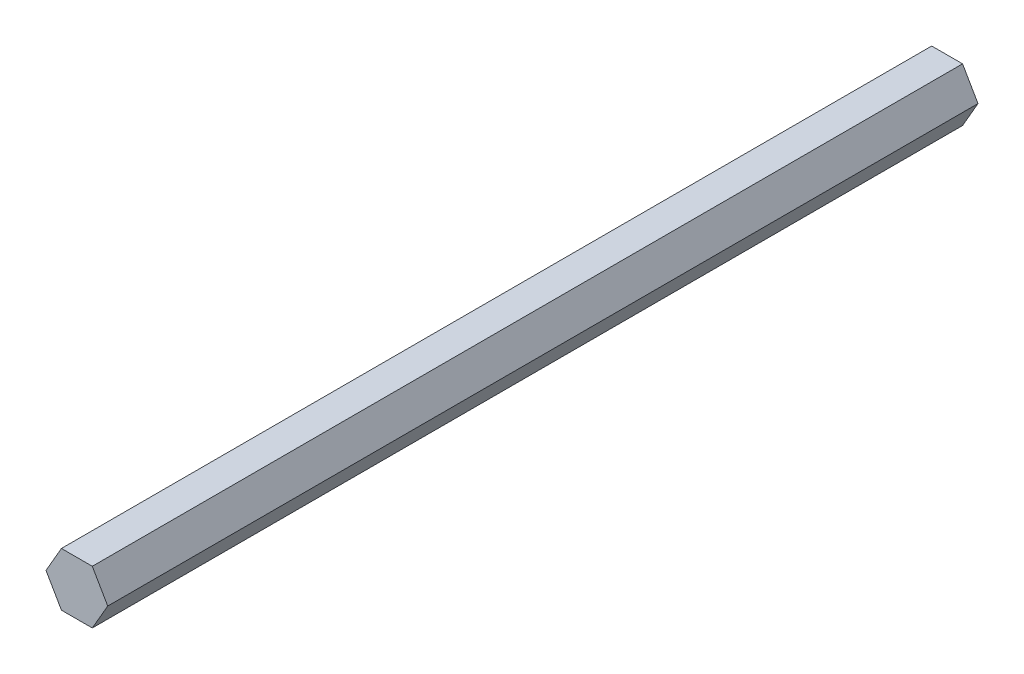
from build123d import *

# Parameters (mm, degrees)
BOSS_EXTRUDE1_DEPTH = 103.378


with BuildPart() as part:
    # Sketch1 → Boss-Extrude1 (new, symmetric)
    with BuildSketch(Plane.XY):
        Polygon((3.666174209, 6.35), (-3.666174209, 6.35), (-7.332348419, 0), (-3.666174209, -6.35), (3.666174209, -6.35), (7.332348419, 0), align=None)
    extrude(amount=BOSS_EXTRUDE1_DEPTH, both=True)


solid = part.part
